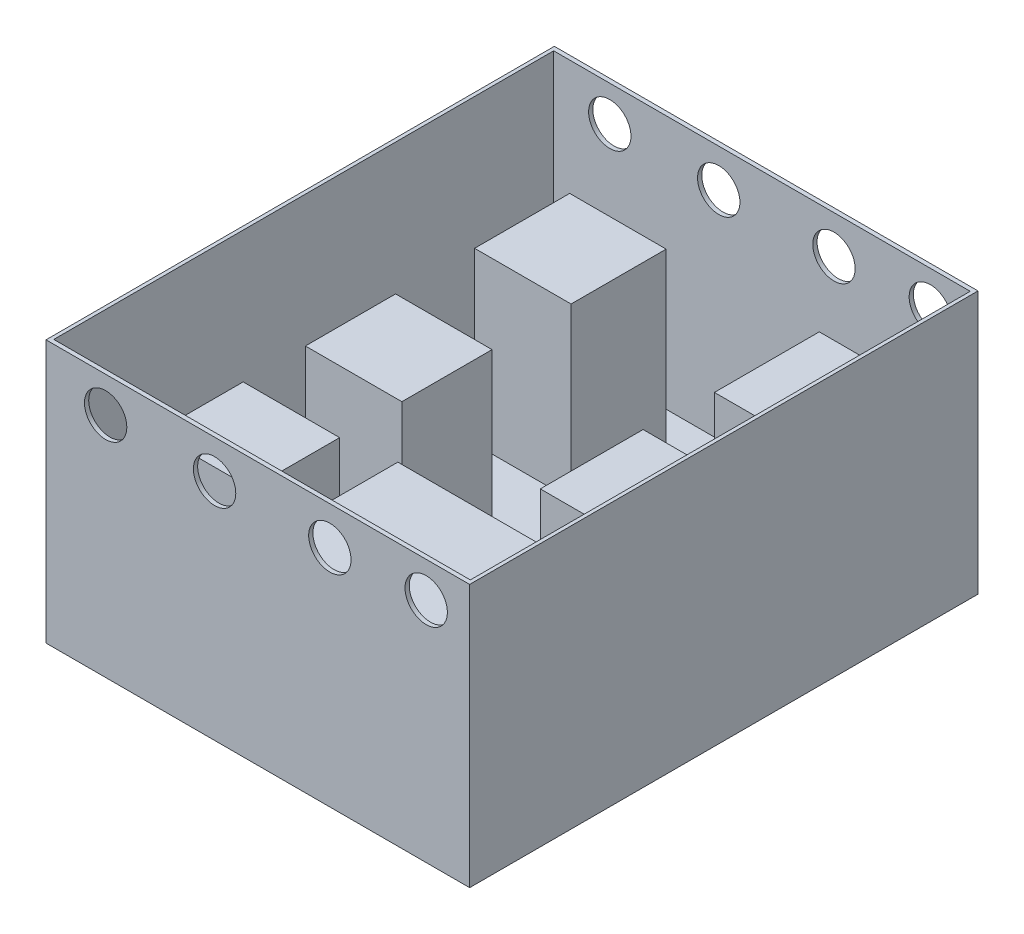
from build123d import *

# Parameters (mm, degrees)
SKETCH1_W           = 1000
SKETCH1_H           = 1200
BOSS_EXTRUDE1_DEPTH = 20
SKETCH2_W           = 1000
SKETCH2_H           = 1200
SKETCH2_W_2         = 983.333333334
SKETCH2_H_2         = 1180
BOSS_EXTRUDE2_DEPTH = 600
SKETCH3_W           = 227.751399754
SKETCH3_H           = 224.45065483
SKETCH3_H_2         = 247.555869298
SKETCH3_H_3         = 212.898047596
SKETCH3_W_2         = 244.255124374
SKETCH3_H_4         = 242.604751912
SKETCH3_H_5         = 207.946930211
SKETCH3_W_3         = 488.510248749
SKETCH3_H_6         = 320.94890349
BOSS_EXTRUDE3_DEPTH = 400
SKETCH13_R          = 50
CUT_EXTRUDE1_DEPTH  = 1441.277750991


with BuildPart() as part:
    # Sketch1 → Boss-Extrude1 (new body)
    with BuildSketch(Plane(origin=(0, 0, 0), x_dir=(1, 0, 0), z_dir=(0, 1, 0))):
        Rectangle(SKETCH1_W, SKETCH1_H)
    extrude(amount=BOSS_EXTRUDE1_DEPTH)

    # Sketch2 → Boss-Extrude2 (add)
    with BuildSketch(Plane(origin=(0, 20, 0), x_dir=(1, 0, 0), z_dir=(0, 1, 0))):
        Rectangle(SKETCH2_W, SKETCH2_H)
        Rectangle(SKETCH2_W_2, SKETCH2_H_2, mode=Mode.SUBTRACT)
    extrude(amount=BOSS_EXTRUDE2_DEPTH)

    # Sketch3 → Boss-Extrude3 (add)
    with BuildSketch(Plane(origin=(0, 20, 0), x_dir=(1, 0, 0), z_dir=(0, 1, 0))):
        with Locations((-267.360338842, 405.166439418)):
            Rectangle(SKETCH3_W, SKETCH3_H)
        with Locations((310.270022854, 405.166439418)):
            Rectangle(SKETCH3_W, SKETCH3_H_2)
        with Locations((-267.360338842, 0)):
            Rectangle(SKETCH3_W, SKETCH3_H_3)
        with Locations((310.270022854, 0)):
            Rectangle(SKETCH3_W_2, SKETCH3_H_4)
        with Locations((-267.360338842, -357.305638021)):
            Rectangle(SKETCH3_W, SKETCH3_H_5)
        with Locations((209.597302673, -395.264204646)):
            Rectangle(SKETCH3_W_3, SKETCH3_H_6)
    extrude(amount=BOSS_EXTRUDE3_DEPTH)

    # Sketch13 → Cut-Extrude1 (cut, through all)
    with BuildSketch(Plane.XY.offset(600)):
        with Locations((-359.206066916, 536.564881977)):
            Circle(SKETCH13_R)
        with Locations((-102.023024923, 530.188442919)):
            Circle(SKETCH13_R)
        with Locations((170.038374872, 530.188442919)):
            Circle(SKETCH13_R)
        with Locations((397.464701262, 536.564881977)):
            Circle(SKETCH13_R)
    extrude(amount=-CUT_EXTRUDE1_DEPTH, mode=Mode.SUBTRACT)


solid = part.part
